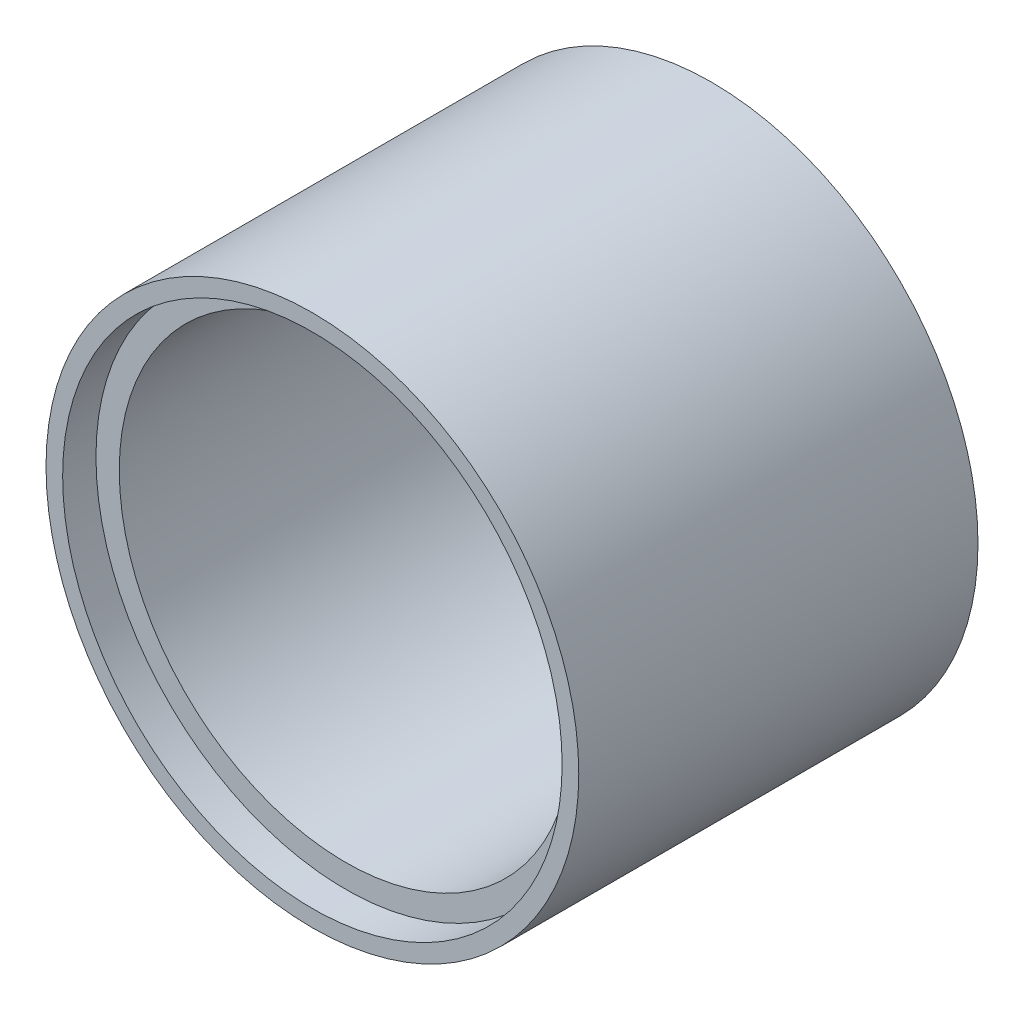
from build123d import *


with BuildPart() as part:
    # Sketch1 → Revolve1 (revolve)
    with BuildSketch(Plane(origin=(0, 0, 0), x_dir=(1, 0, 0), z_dir=(0, 1, 0))):
        Polygon((-34, 24.974675494), (-34, -24.974675494), (-37.5, -24.974675494), (-37.5, -29.974675494), (-40, -29.974675494), (-40, 29.974675494), (-37.5, 29.974675494), (-37.5, 24.974675494), align=None)
    revolve(axis=Axis((0, 0, -51.375971746), (0, 0, 1)))


solid = part.part
